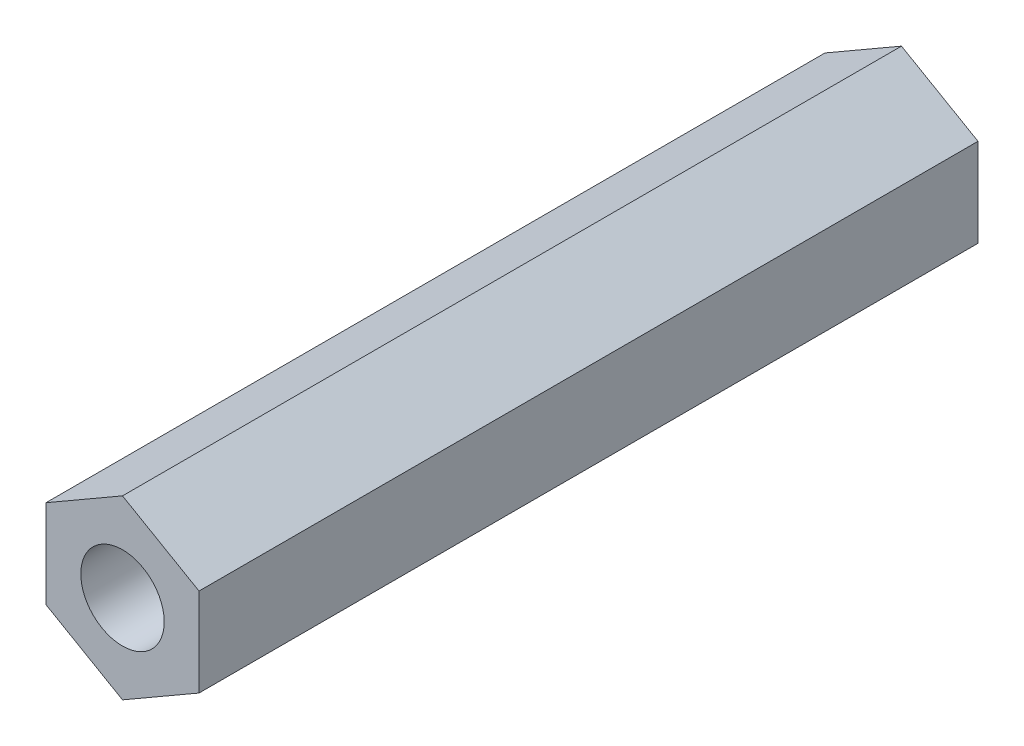
from build123d import *

# Parameters (mm, degrees)
ESQUISSE1_R        = 1.5
BOSS_EXTRU_1_DEPTH = 28


with BuildPart() as part:
    # Esquisse1 → Boss.-Extru.1 (new body)
    with BuildSketch(Plane.XY):
        Polygon((0, -3.175426481), (2.75, -1.58771324), (2.75, 1.58771324), (0, 3.175426481), (-2.75, 1.58771324), (-2.75, -1.58771324), align=None)
        Circle(ESQUISSE1_R, mode=Mode.SUBTRACT)
    extrude(amount=BOSS_EXTRU_1_DEPTH)


solid = part.part
